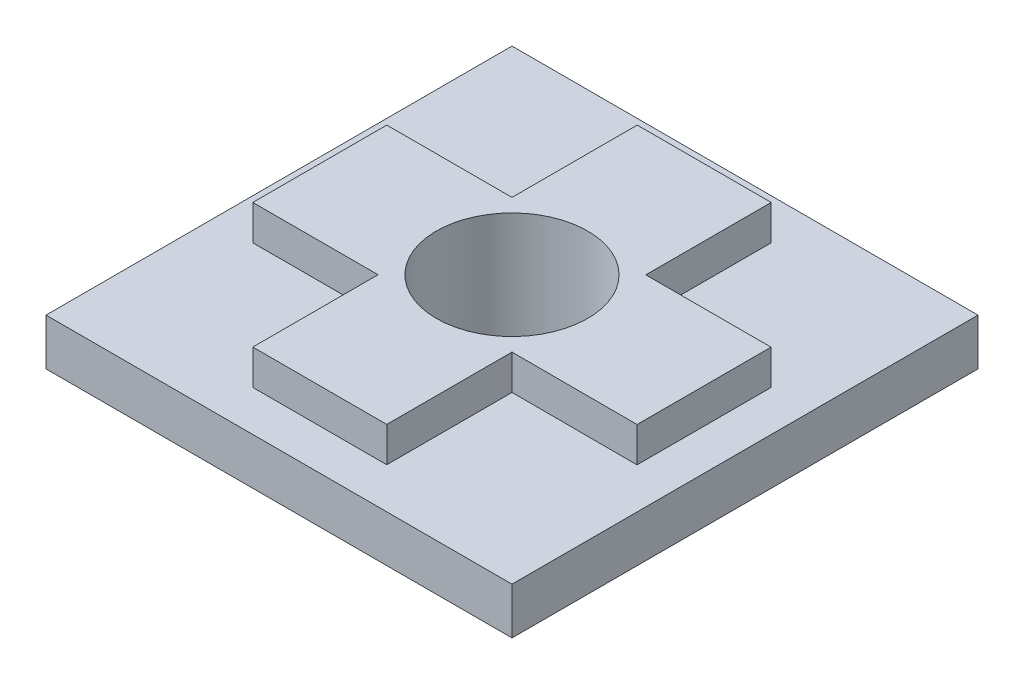
from build123d import *

# Parameters (mm, degrees)
SKETCH1_W                      = 20
SKETCH1_H                      = 20
BOSS_EXTRUDE1_DEPTH            = 2
BOSS_EXTRUDE3_DEPTH            = 1.5
BOSS_EXTRUDE3_DEPTH_BACK       = 3.5
TAP_DRILL_FOR_M2_2_HELICOIL1_D = 6.5


with BuildPart() as part:
    # Sketch1 → Boss-Extrude1 (new body)
    with BuildSketch(Plane(origin=(0, 0, 0), x_dir=(1, 0, 0), z_dir=(0, 1, 0))):
        Rectangle(SKETCH1_W, SKETCH1_H)
    extrude(amount=BOSS_EXTRUDE1_DEPTH)

    # Sketch3 → Boss-Extrude3 (add, two sides: drawn at the far end of the back side and taken through both)
    with BuildSketch(Plane(origin=(0, 2, 0), x_dir=(1, 0, 0), z_dir=(0, 1, 0)).offset(-BOSS_EXTRUDE3_DEPTH_BACK)):
        Polygon((-2.875, 8.25), (2.875, 8.25), (2.875, 2.867474963), (8.25, 2.867474963), (8.25, -2.882525037), (2.875, -2.875), (2.875, -8.25), (-2.875, -8.25), (-2.875, -2.875), (-8.25, -2.875), (-8.25, 2.875), (-2.875, 2.875), align=None)
    extrude(amount=BOSS_EXTRUDE3_DEPTH + BOSS_EXTRUDE3_DEPTH_BACK)

    # Tap Drill for M2.2 Helicoil1 (through all)
    with Locations(Plane.ZX.offset(3.5)):
        with Locations((0, 0)):
            Hole(TAP_DRILL_FOR_M2_2_HELICOIL1_D / 2)


solid = part.part
